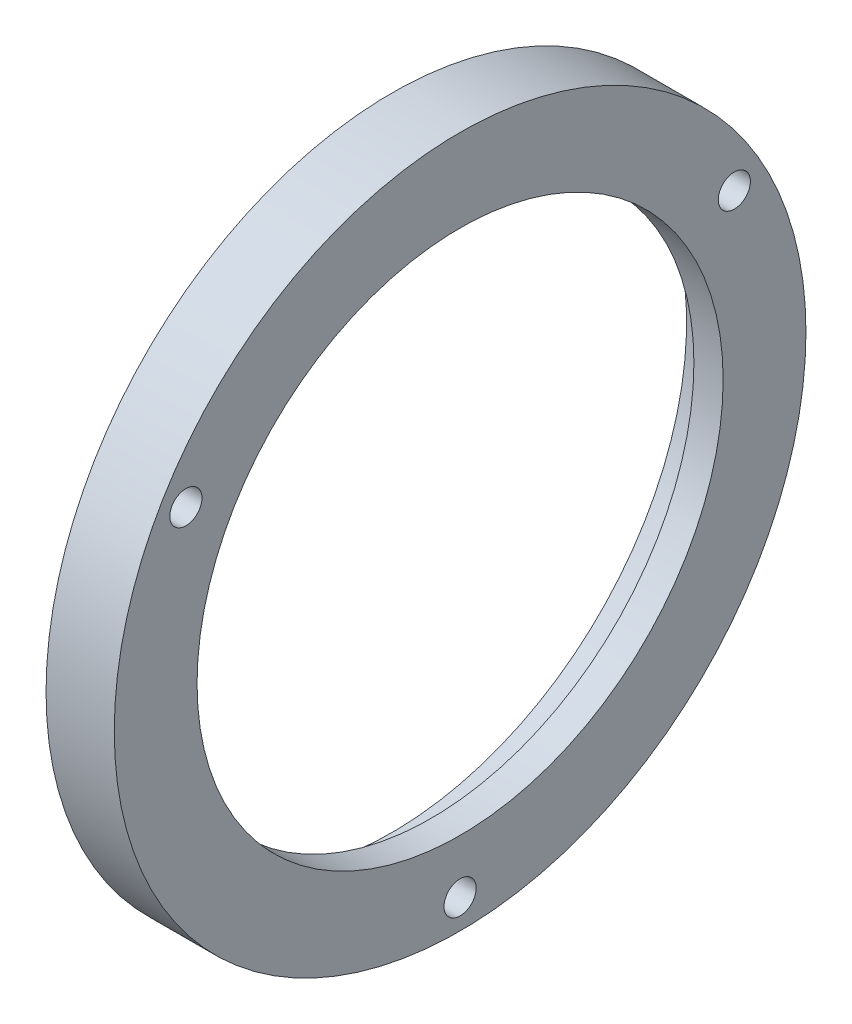
from build123d import *

# Parameters (mm, degrees)
AXIAL_HOLES_DEPTH      = 152.273890675
AXIAL_HOLES_DEPTH_BACK = 152.273890675
SKETCH2_R              = 1.65


with BuildPart() as part:
    # Axial profile (mm) → Full revolution (revolve)
    with BuildSketch(Plane.XY, mode=Mode.PRIVATE) as full_revolution_sk:
        Polygon((135.7, 30.25), (139.7, 30.25), (139.7, 27), (142.7, 27), (142.7, 35.5), (135.7, 35.5), align=None)
    revolve(full_revolution_sk.sketch.rotate(Axis((-110, 0, 0), (1, 0, 0)), 90), axis=Axis((-110, 0, 0), (1, 0, 0)))

    # Sketch2 → Axial holes (cut, two sides: drawn at the far end of the back side and taken through both)
    with BuildSketch(Plane(origin=(0, 0, 0), x_dir=(0, 0, -1), z_dir=(1, 0, 0)).offset(-AXIAL_HOLES_DEPTH_BACK)):
        with Locations((-28.145825623, 16.25)):
            Circle(SKETCH2_R)
        with Locations((0, -32.5)):
            Circle(SKETCH2_R)
        with Locations((28.145825623, 16.25)):
            Circle(SKETCH2_R)
    extrude(amount=AXIAL_HOLES_DEPTH + AXIAL_HOLES_DEPTH_BACK, mode=Mode.SUBTRACT)


solid = part.part
